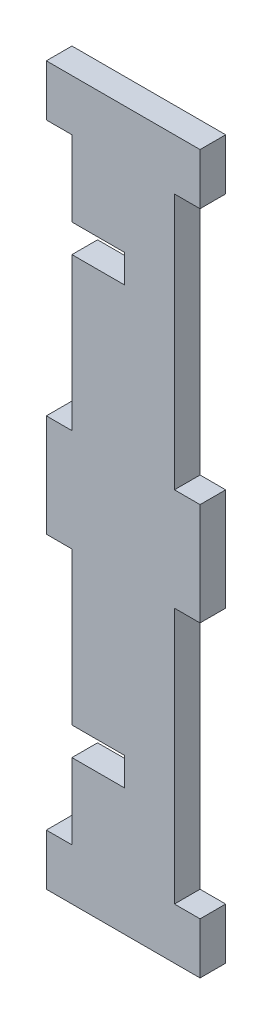
from build123d import *

# Parameters (mm, degrees)
BOSS_EXTRUDE1_DEPTH = 2.5


with BuildPart() as part:
    # Sketch2 → Boss-Extrude1 (new, symmetric)
    with BuildSketch(Plane.XY):
        Polygon((-1086.454340614, -212.296998666), (-1116.454340614, -212.29700175), (-1116.454341642, -202.29700175), (-1111.454341642, -202.297001236), (-1111.454343158, -187.547001236), (-1101.204343158, -187.547000182), (-1101.204343723, -182.047000182), (-1111.454343723, -182.047001236), (-1111.454346781, -152.297001236), (-1116.454346781, -152.29700175), (-1116.454348836, -132.296996662), (-1111.454348836, -132.296996148), (-1111.454351894, -102.546996148), (-1101.204351894, -102.546995095), (-1101.204352459, -97.046995095), (-1111.454352459, -97.046996148), (-1111.454353975, -82.296996148), (-1116.454353975, -82.296996662), (-1116.454355003, -72.296996662), (-1086.454355003, -72.296993579), (-1086.454353975, -82.296993579), (-1091.454353975, -82.296994093), (-1091.454348836, -132.296994093), (-1086.454348836, -132.296993579), (-1086.454346781, -152.296998666), (-1091.454346781, -152.29699918), (-1091.454341642, -202.29699918), (-1086.454341642, -202.296998666), align=None)
    extrude(amount=BOSS_EXTRUDE1_DEPTH, both=True)


solid = part.part
